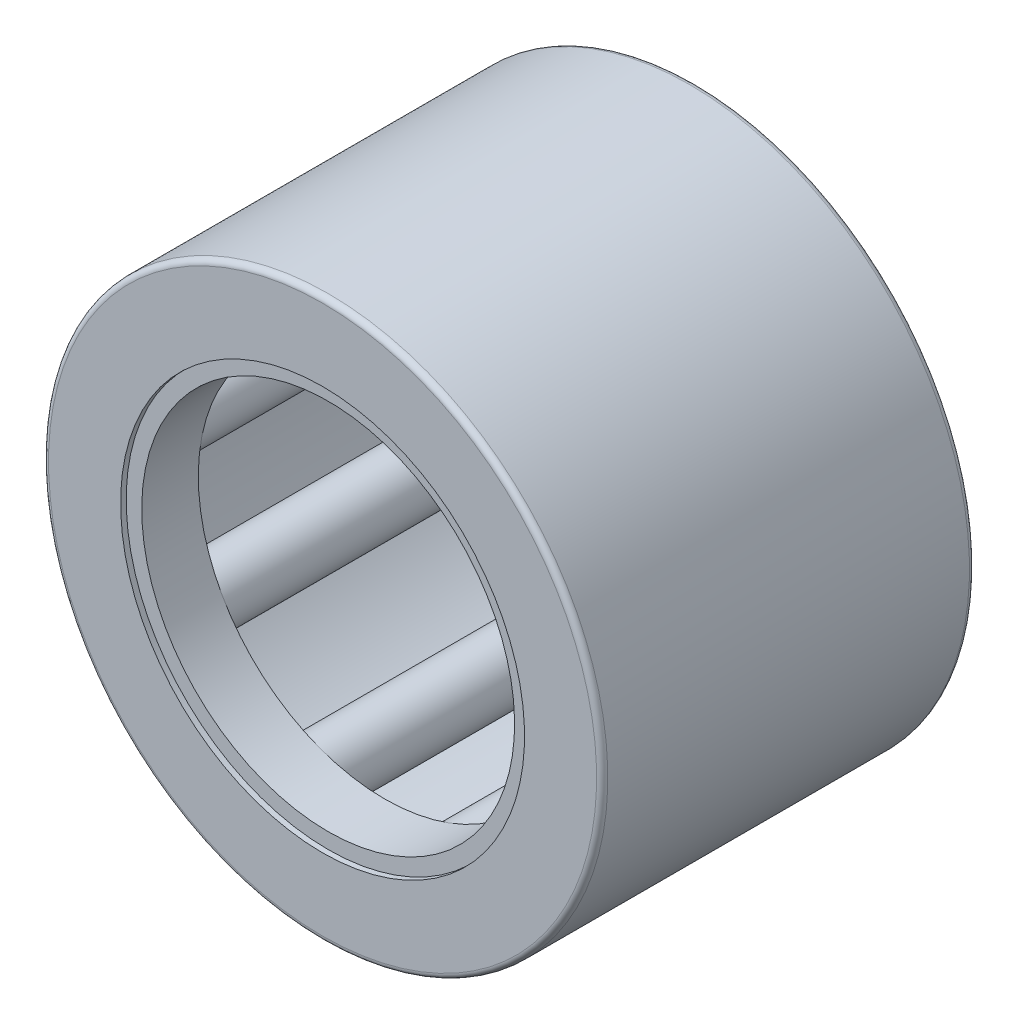
from build123d import *

# Parameters (mm, degrees)
SKETCH2_W         = 5.333333334
SKETCH2_H         = 0.5
SKETCH3_W         = 6.666666666
SKETCH3_H         = 0.166666666
CIRPATTERN1_COUNT = 9
CIRPATTERN1_ANGLE = 320
FILLET1_R         = 0.12
SKETCH4_W         = 1.213333333
SKETCH4_H         = 0.333333333
SKETCH5_W         = 1.213333333
SKETCH5_H         = 0.333333333


with BuildPart() as part:
    # Sketch7 → Revolve1 (revolve)
    with BuildSketch(Plane(origin=(0, 0, 0), x_dir=(0, 0, -1), z_dir=(1, 0, 0)), mode=Mode.PRIVATE) as revolve1_sk:
        Polygon((-4, 6), (-4, 4.333333333), (-3.333333333, 4.333333333), (-3.333333333, 5.333333333), (3.333333333, 5.333333333), (3.333333333, 4.333333333), (4, 4.333333333), (4, 6), align=None)
    revolve(revolve1_sk.sketch.rotate(Axis((0, 0, 4), (0, 0, -1)), 180), axis=Axis((0, 0, 4), (0, 0, -1)))

    # Fillet1
    fillet1_edges = [part.edges().sort_by_distance(p)[0] for p in [
        (0, 6, -4),
        (0, 6, 4),
    ]]
    fillet(fillet1_edges, radius=FILLET1_R)


with BuildPart() as body_2:
    # Sketch2 → Revolve2 (revolve)
    with BuildSketch(Plane(origin=(0, 0, 0), x_dir=(0, 0, -1), z_dir=(1, 0, 0)), mode=Mode.PRIVATE) as revolve2_sk:
        with Locations((0, 5.083333333)):
            Rectangle(SKETCH2_W, SKETCH2_H)
    revolve(revolve2_sk.sketch.rotate(Axis((0, 4.666666667, 2.666666667), (0, 0, -1)), 180), axis=Axis((0, 4.666666667, 2.666666667), (0, 0, -1)))


with BuildPart() as body_3:
    # Sketch3 → Revolve3 (revolve)
    with BuildSketch(Plane(origin=(0, 0, 0), x_dir=(0, 0, -1), z_dir=(1, 0, 0)), mode=Mode.PRIVATE) as revolve3_sk:
        with Locations((0, 4.75)):
            Rectangle(SKETCH3_W, SKETCH3_H)
    revolve(revolve3_sk.sketch.rotate(Axis((0, 4.666666667, 3.333333333), (0, 0, -1)), 90), axis=Axis((0, 4.666666667, 3.333333333), (0, 0, -1)))


with BuildPart() as cirpattern1_1:
    # CirPattern1: pattern copy
    add(body_2.part.rotate(Axis((0, 0, 4), (0, 0, -1)), 1 * CIRPATTERN1_ANGLE / (CIRPATTERN1_COUNT - 1)))


with BuildPart() as cirpattern1_2:
    # CirPattern1: pattern copy
    add(body_2.part.rotate(Axis((0, 0, 4), (0, 0, -1)), 2 * CIRPATTERN1_ANGLE / (CIRPATTERN1_COUNT - 1)))


with BuildPart() as cirpattern1_3:
    # CirPattern1: pattern copy
    add(body_2.part.rotate(Axis((0, 0, 4), (0, 0, -1)), 3 * CIRPATTERN1_ANGLE / (CIRPATTERN1_COUNT - 1)))


with BuildPart() as cirpattern1_4:
    # CirPattern1: pattern copy
    add(body_2.part.rotate(Axis((0, 0, 4), (0, 0, -1)), 4 * CIRPATTERN1_ANGLE / (CIRPATTERN1_COUNT - 1)))


with BuildPart() as cirpattern1_5:
    # CirPattern1: pattern copy
    add(body_2.part.rotate(Axis((0, 0, 4), (0, 0, -1)), 5 * CIRPATTERN1_ANGLE / (CIRPATTERN1_COUNT - 1)))


with BuildPart() as cirpattern1_6:
    # CirPattern1: pattern copy
    add(body_2.part.rotate(Axis((0, 0, 4), (0, 0, -1)), 6 * CIRPATTERN1_ANGLE / (CIRPATTERN1_COUNT - 1)))


with BuildPart() as cirpattern1_7:
    # CirPattern1: pattern copy
    add(body_2.part.rotate(Axis((0, 0, 4), (0, 0, -1)), 7 * CIRPATTERN1_ANGLE / (CIRPATTERN1_COUNT - 1)))


with BuildPart() as cirpattern1_8:
    # CirPattern1: pattern copy
    add(body_2.part.rotate(Axis((0, 0, 4), (0, 0, -1)), 8 * CIRPATTERN1_ANGLE / (CIRPATTERN1_COUNT - 1)))


with BuildPart() as cirpattern1_9:
    # CirPattern1: pattern copy
    add(body_3.part.rotate(Axis((0, 0, 4), (0, 0, -1)), 1 * CIRPATTERN1_ANGLE / (CIRPATTERN1_COUNT - 1)))


with BuildPart() as cirpattern1_10:
    # CirPattern1: pattern copy
    add(body_3.part.rotate(Axis((0, 0, 4), (0, 0, -1)), 2 * CIRPATTERN1_ANGLE / (CIRPATTERN1_COUNT - 1)))


with BuildPart() as cirpattern1_11:
    # CirPattern1: pattern copy
    add(body_3.part.rotate(Axis((0, 0, 4), (0, 0, -1)), 3 * CIRPATTERN1_ANGLE / (CIRPATTERN1_COUNT - 1)))


with BuildPart() as cirpattern1_12:
    # CirPattern1: pattern copy
    add(body_3.part.rotate(Axis((0, 0, 4), (0, 0, -1)), 4 * CIRPATTERN1_ANGLE / (CIRPATTERN1_COUNT - 1)))


with BuildPart() as cirpattern1_13:
    # CirPattern1: pattern copy
    add(body_3.part.rotate(Axis((0, 0, 4), (0, 0, -1)), 5 * CIRPATTERN1_ANGLE / (CIRPATTERN1_COUNT - 1)))


with BuildPart() as cirpattern1_14:
    # CirPattern1: pattern copy
    add(body_3.part.rotate(Axis((0, 0, 4), (0, 0, -1)), 6 * CIRPATTERN1_ANGLE / (CIRPATTERN1_COUNT - 1)))


with BuildPart() as cirpattern1_15:
    # CirPattern1: pattern copy
    add(body_3.part.rotate(Axis((0, 0, 4), (0, 0, -1)), 7 * CIRPATTERN1_ANGLE / (CIRPATTERN1_COUNT - 1)))


with BuildPart() as cirpattern1_16:
    # CirPattern1: pattern copy
    add(body_3.part.rotate(Axis((0, 0, 4), (0, 0, -1)), 8 * CIRPATTERN1_ANGLE / (CIRPATTERN1_COUNT - 1)))


with BuildPart() as body_20:
    # Sketch4 → Revolve4 (revolve)
    with BuildSketch(Plane(origin=(0, 0, 0), x_dir=(0, 0, -1), z_dir=(1, 0, 0)), mode=Mode.PRIVATE) as revolve4_sk:
        with Locations((3.273333334, 4.166666667)):
            Rectangle(SKETCH4_W, SKETCH4_H)
    revolve(revolve4_sk.sketch.rotate(Axis((0, 0, 4), (0, 0, -1)), 180), axis=Axis((0, 0, 4), (0, 0, -1)))


with BuildPart() as body_21:
    # Sketch5 → Revolve5 (revolve)
    with BuildSketch(Plane(origin=(0, 0, 0), x_dir=(0, 0, -1), z_dir=(1, 0, 0)), mode=Mode.PRIVATE) as revolve5_sk:
        with Locations((-3.273333334, 4.166666667)):
            Rectangle(SKETCH5_W, SKETCH5_H)
    revolve(revolve5_sk.sketch.rotate(Axis((0, 0, 4), (0, 0, -1)), 180), axis=Axis((0, 0, 4), (0, 0, -1)))


solid = Compound([part.part, body_2.part, body_3.part, cirpattern1_1.part, cirpattern1_2.part, cirpattern1_3.part, cirpattern1_4.part, cirpattern1_5.part, cirpattern1_6.part, cirpattern1_7.part, cirpattern1_8.part, cirpattern1_9.part, cirpattern1_10.part, cirpattern1_11.part, cirpattern1_12.part, cirpattern1_13.part, cirpattern1_14.part, cirpattern1_15.part, cirpattern1_16.part, body_20.part, body_21.part])
